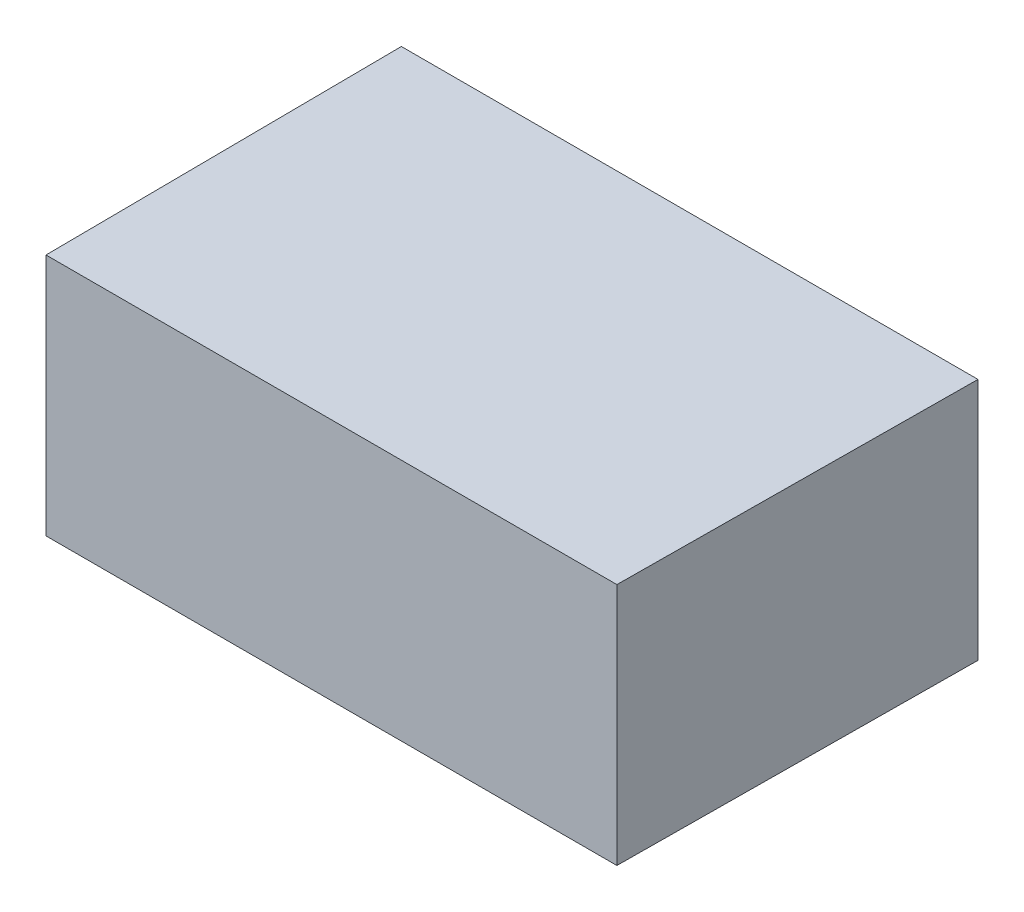
from build123d import *

# Parameters (mm, degrees)
SKETCH_1_W            = 150.5
SKETCH_1_H            = 63.5
EXTRUDE_1_DEPTH       = 93.5
SKETCH_2_W            = 1
SKETCH_2_H            = 7
CUT_EXTRUDE_831_DEPTH = 136.783145125


with BuildPart() as part:
    # 草图1 → 拉伸1 (new body)
    with BuildSketch(Plane.XY):
        Rectangle(SKETCH_1_W, SKETCH_1_H)
    extrude(amount=EXTRUDE_1_DEPTH)

    # 扫描1: sweep along a path in 草图3
    with BuildLine(Plane(origin=(0, 19, 0), x_dir=(-1, 0, 0), z_dir=(0, 1, 0))) as sweep_1_path:
        Line((59.75, 0), (59.75, -4))
        Line((59.75, -4), (48.75, -4))
    # 草图2 → 扫描1 (sweep)
    with BuildSketch(Plane(origin=(0, 0, 0), x_dir=(-1, 0, 0), z_dir=(0, 0, -1))):
        with Locations((59.75, 21.25)):
            Rectangle(SKETCH_2_W, SKETCH_2_H)
    sweep_1 = sweep(path=sweep_1_path.line, transition=Transition.RIGHT)

    # 镜向1: 扫描1 across plane
    add(sweep_1.mirror(Plane.ZX))

    # 草图5 → Cut-Extrude 831 (cut, through all)
    with BuildSketch(Plane.XZ.offset(31.75)):
        Polygon((-75.25, 0), (-74.5, 93.5), (-75.25, 93.5), align=None)
        Polygon((74.5, 93.5), (75.25, 93.5), (75.25, 0), align=None)
    extrude(amount=-CUT_EXTRUDE_831_DEPTH, mode=Mode.SUBTRACT)


solid = part.part
